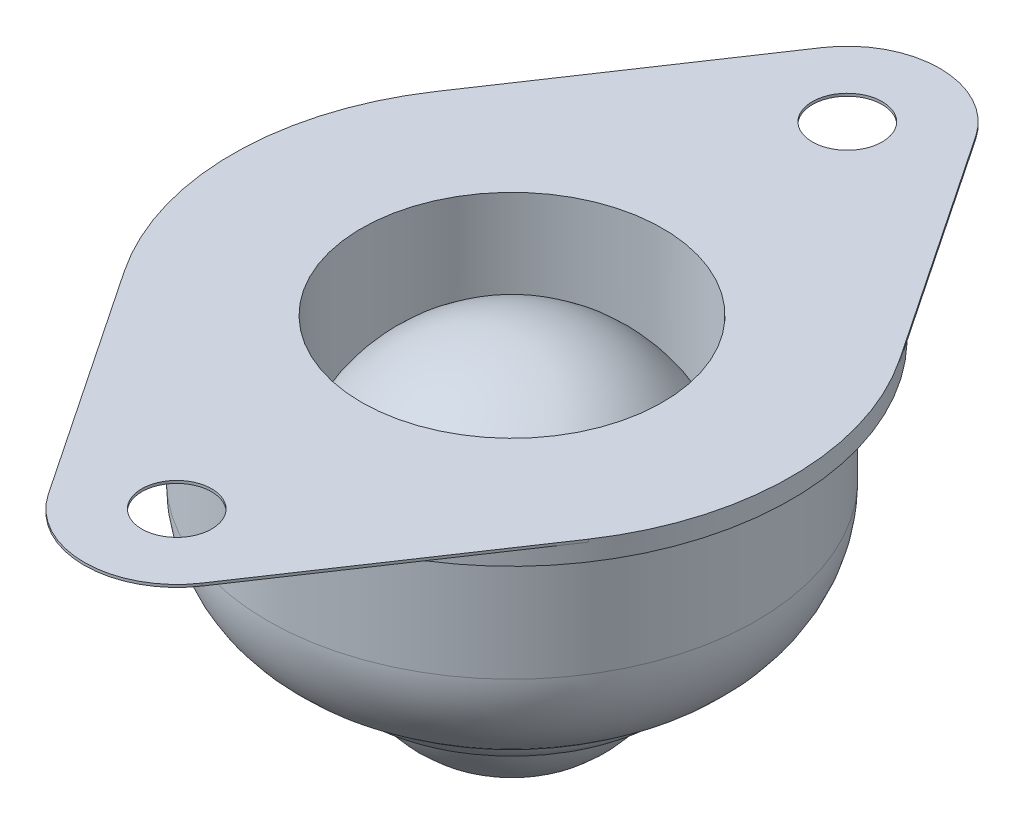
from build123d import *

# Parameters (mm, degrees)
SKETCH2_R           = 8.626283366
SKETCH2_R_2         = 2
BOSS_EXTRUDE2_DEPTH = 0.15


with BuildPart() as part:
    # Sketch1 → Revolve1 (revolve)
    with BuildSketch(Plane.XY, mode=Mode.PRIVATE) as revolve1_sk:
        with BuildLine():
            Line((16, 21.11), (16, 20.123658445))
            ThreePointArc((16, 20.123658445), (14.844631277, 19.923379665), (14, 19.11))
            Line((14, 19.11), (14, 13.11))
            ThreePointArc((14, 13.11), (12.760912849, 9.212301981), (9.498573932, 6.745617646))
            ThreePointArc((9.498573932, 6.745617646), (8.602056269, 5.471944767), (7.096455966, 5.073003354))
            ThreePointArc((7.096455966, 5.073003354), (4.361623846, 1.398669209), (0, 0))
            Line((0, 0), (0, 20.221919192))
            ThreePointArc((0, 20.221919192), (5.230275248, 18.600523967), (8.626283366, 14.304964573))
            Line((8.626283366, 14.304964573), (8.626283366, 21.11))
            Line((8.626283366, 21.11), (16, 21.11))
        make_face()
    revolve(revolve1_sk.sketch.rotate(Axis((0, 20.221919192, 0), (0, -1, 0)), 90), axis=Axis((0, 20.221919192, 0), (0, -1, 0)))

    # Sketch2 → Boss-Extrude2 (add)
    with BuildSketch(Plane(origin=(0, 21.11, 0), x_dir=(1, 0, 0), z_dir=(0, 1, 0))):
        with BuildLine():
            Line((-4.400679072, -22.153645833), (-13.285068895, -8.916666667))
            ThreePointArc((-13.285068895, -8.916666667), (-16, 0), (-13.285068895, 8.916666667))
            Line((-13.285068895, 8.916666667), (-4.400679072, 22.153645833))
            ThreePointArc((-4.400679072, 22.153645833), (0, 24.5), (4.400679072, 22.153645833))
            Line((4.400679072, 22.153645833), (13.285068895, 8.916666667))
            ThreePointArc((13.285068895, 8.916666667), (16, 0), (13.285068895, -8.916666667))
            Line((13.285068895, -8.916666667), (4.400679072, -22.153645833))
            ThreePointArc((4.400679072, -22.153645833), (0, -24.5), (-4.400679072, -22.153645833))
        make_face()
        with Locations(Location((0, 0, 0), (0, 0, 270))):
            Circle(SKETCH2_R, mode=Mode.SUBTRACT)
        with Locations(Location((0, -19.2, 0), (0, 0, 270))):
            Circle(SKETCH2_R_2, mode=Mode.SUBTRACT)
        with Locations(Location((0, 19.2, 0), (0, 0, 270))):
            Circle(SKETCH2_R_2, mode=Mode.SUBTRACT)
    extrude(amount=BOSS_EXTRUDE2_DEPTH)


solid = part.part
